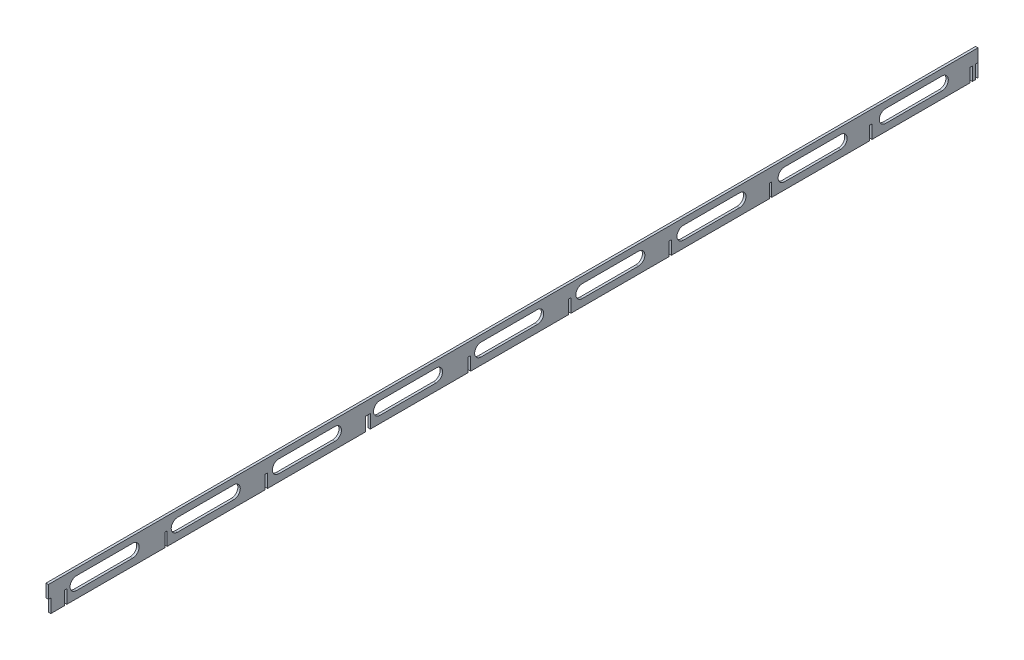
from build123d import *

# Parameters (mm, degrees)
SKETCH_1_W          = 3
SKETCH_1_H          = 32.905807398
EXTRUDE_1_DEPTH     = 1158
SKETCH_2_W          = 3
SKETCH_2_H          = 16.828171787
SKETCH_2_W_2        = 2.99
CUT_EXTRUDE_1_DEPTH = 3


with BuildPart() as part:
    # 草图1 → 凸台-拉伸1 (new body)
    with BuildSketch(Plane.XY):
        with Locations((-45.625456821, 5.194351007)):
            Rectangle(SKETCH_1_W, SKETCH_1_H)
    extrude(amount=EXTRUDE_1_DEPTH)

    # 草图2 → 切除-拉伸1 (cut)
    with BuildSketch(Plane.ZY.offset(47.125456821)):
        with Locations((1.51, -2.844466799)):
            Rectangle(SKETCH_2_W, SKETCH_2_H)
        with Locations((8.51, -2.844466799)):
            Rectangle(SKETCH_2_W, SKETCH_2_H)
        with BuildLine():
            Line((45, -2.352745294), (115, -2.352745294))
            ThreePointArc((115, -2.352745294), (123, 5.647254706), (115, 13.647254706))
            Line((115, 13.647254706), (45, 13.647254706))
            ThreePointArc((45, 13.647254706), (37, 5.647254706), (45, -2.352745294))
        make_face()
        with Locations((133.51, -2.844466799)):
            Rectangle(SKETCH_2_W, SKETCH_2_H)
        with BuildLine():
            Line((171, -2.352745294), (241, -2.352745294))
            ThreePointArc((241, -2.352745294), (249, 5.647254706), (241, 13.647254706))
            Line((241, 13.647254706), (171, 13.647254706))
            ThreePointArc((171, 13.647254706), (163, 5.647254706), (171, -2.352745294))
        make_face()
        with Locations((258.51, -2.844466799)):
            Rectangle(SKETCH_2_W, SKETCH_2_H)
        with BuildLine():
            Line((297, -2.352745294), (367, -2.352745294))
            ThreePointArc((367, -2.352745294), (375, 5.647254706), (367, 13.647254706))
            Line((367, 13.647254706), (297, 13.647254706))
            ThreePointArc((297, 13.647254706), (289, 5.647254706), (297, -2.352745294))
        make_face()
        with Locations((383.51, -2.844466799)):
            Rectangle(SKETCH_2_W, SKETCH_2_H)
        with BuildLine():
            Line((423, -2.352745294), (493, -2.352745294))
            ThreePointArc((493, -2.352745294), (501, 5.647254706), (493, 13.647254706))
            Line((493, 13.647254706), (423, 13.647254706))
            ThreePointArc((423, 13.647254706), (415, 5.647254706), (423, -2.352745294))
        make_face()
        with Locations((508.51, -2.844466799)):
            Rectangle(SKETCH_2_W, SKETCH_2_H)
        with BuildLine():
            Line((549, -2.352745294), (619, -2.352745294))
            ThreePointArc((619, -2.352745294), (627, 5.647254706), (619, 13.647254706))
            Line((619, 13.647254706), (549, 13.647254706))
            ThreePointArc((549, 13.647254706), (541, 5.647254706), (549, -2.352745294))
        make_face()
        with Locations((633.51, -2.844466799)):
            Rectangle(SKETCH_2_W, SKETCH_2_H)
        with BuildLine():
            Line((675, -2.352745294), (745, -2.352745294))
            ThreePointArc((745, -2.352745294), (753, 5.647254706), (745, 13.647254706))
            Line((745, 13.647254706), (675, 13.647254706))
            ThreePointArc((675, 13.647254706), (667, 5.647254706), (675, -2.352745294))
        make_face()
        with Locations((758.51, -2.844466799)):
            Rectangle(SKETCH_2_W, SKETCH_2_H)
        with Locations((761.51, -2.844466799)):
            Rectangle(SKETCH_2_W, SKETCH_2_H)
        with BuildLine():
            Line((801, -2.352745294), (871, -2.352745294))
            ThreePointArc((871, -2.352745294), (879, 5.647254706), (871, 13.647254706))
            Line((871, 13.647254706), (801, 13.647254706))
            ThreePointArc((801, 13.647254706), (793, 5.647254706), (801, -2.352745294))
        make_face()
        with Locations((886.51, -2.844466799)):
            Rectangle(SKETCH_2_W, SKETCH_2_H)
        with BuildLine():
            Line((927, -2.352745294), (997, -2.352745294))
            ThreePointArc((997, -2.352745294), (1005, 5.647254706), (997, 13.647254706))
            Line((997, 13.647254706), (927, 13.647254706))
            ThreePointArc((927, 13.647254706), (919, 5.647254706), (927, -2.352745294))
        make_face()
        with Locations((1011.51, -2.844466799)):
            Rectangle(SKETCH_2_W, SKETCH_2_H)
        with BuildLine():
            Line((1053, -2.352745294), (1123, -2.352745294))
            ThreePointArc((1123, -2.352745294), (1131, 5.647254706), (1123, 13.647254706))
            Line((1123, 13.647254706), (1053, 13.647254706))
            ThreePointArc((1053, 13.647254706), (1045, 5.647254706), (1053, -2.352745294))
        make_face()
        with Locations((1136.51, -2.844466799)):
            Rectangle(SKETCH_2_W, SKETCH_2_H)
        with Locations((1156.505, -2.844466799)):
            Rectangle(SKETCH_2_W_2, SKETCH_2_H)
    extrude(amount=-CUT_EXTRUDE_1_DEPTH, mode=Mode.SUBTRACT)


solid = part.part
